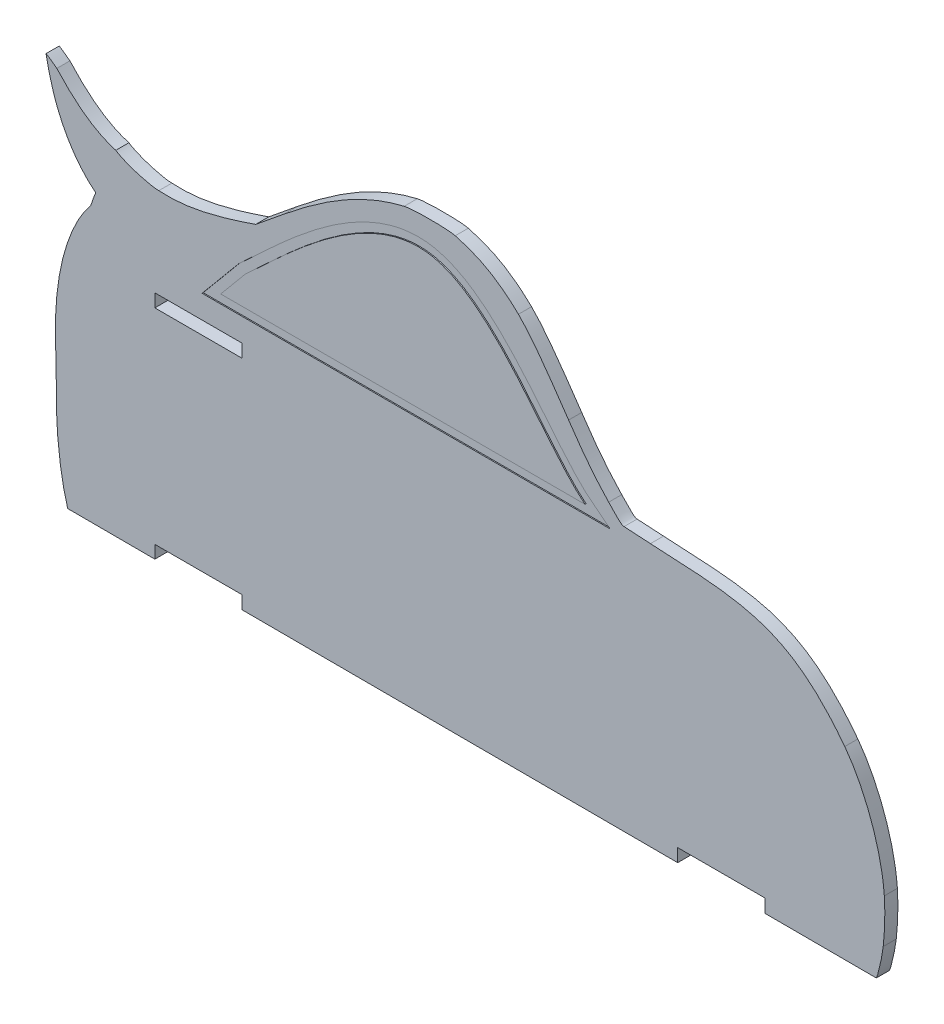
from build123d import *

# Parameters (mm, degrees)
BOSS_EXTRUDE1_DEPTH = 3
SKETCH2_W           = 20
SKETCH2_H           = 3
CUT_EXTRUDE1_DEPTH  = 10
CUT_EXTRUDE2_DEPTH  = 0.25
FILLET1_R           = 490
FILLET3_R           = 20


with BuildPart() as part:
    # Sketch1 → Boss-Extrude1 (new body)
    with BuildSketch(Plane.XY):
        with BuildLine():
            Line((-55.771613477, 211.884964235), (-81.359563224, 211.955586631))
            Line((-81.359563224, 211.955586631), (-81.359563224, 215.010786361))
            Line((-81.359563224, 215.010786361), (-101.359563224, 215.010786361))
            Line((-101.359563224, 215.010786361), (-101.359563224, 212.010786361))
            Line((-101.359563224, 212.010786361), (-201.35903, 212.28678354))
            Line((-201.35903, 212.28678354), (-201.35903, 215.28678354))
            Line((-201.35903, 215.28678354), (-221.35903, 215.28678354))
            Line((-221.35903, 215.28678354), (-221.35903, 212.34198327))
            Line((-221.35903, 212.34198327), (-241.35903, 212.397183))
            add(Edge.make_bspline(
                [(-241.35903, 212.397183), (-243.433200806, 219.233539852), (-244.37501358, 229.532087014), (-243.767840249, 238.737074774)],
                knots=[0, 0, 0, 0, 1, 1, 1, 1], degree=3))
            add(Edge.make_bspline(
                [(-243.767840249, 238.737074774), (-245.3417367, 253.755030644), (-242.442141826, 267.557324246), (-236.098911434, 275.241845869)],
                knots=[0, 0, 0, 0, 1, 1, 1, 1], degree=3))
            add(Edge.make_bspline(
                [(-236.098911434, 275.241845869), (-235.734186419, 276.060814752), (-235.537632123, 276.743555368), (-235.662116873, 276.759057769)],
                knots=[0, 0, 0, 0, 1, 1, 1, 1], degree=3))
            add(Edge.make_bspline(
                [(-235.662116873, 276.759057769), (-235.591127974, 276.862477635), (-235.260826653, 277.597138511), (-234.928115217, 278.391644727)],
                knots=[0, 0, 0, 0, 1, 1, 1, 1], degree=3))
            add(Edge.make_bspline(
                [(-234.928115217, 278.391644727), (-239.348910331, 281.793983673), (-243.122699165, 287.939625439), (-245.028490728, 294.840167335)],
                knots=[0, 0, 0, 0, 1, 1, 1, 1], degree=3))
            add(Edge.make_bspline(
                [(-245.028490728, 294.840167335), (-245.550247129, 296.573870804), (-246.403646496, 300.250938453), (-246.310899804, 300.365745035)],
                knots=[0, 0, 0, 0, 1, 1, 1, 1], degree=3))
            add(Edge.make_bspline(
                [(-246.310899804, 300.365745035), (-246.297955678, 300.428351845), (-245.194510621, 299.656108866), (-243.858829054, 298.649604138)],
                knots=[0, 0, 0, 0, 1, 1, 1, 1], degree=3))
            add(Edge.make_bspline(
                [(-243.858829054, 298.649604138), (-239.139760648, 293.437037617), (-234.88048493, 290.445021181), (-230.313280496, 289.134244505)],
                knots=[0, 0, 0, 0, 1, 1, 1, 1], degree=3))
            add(Edge.make_bspline(
                [(-230.313280496, 289.134244505), (-228.476266882, 287.808285747), (-222.916561014, 286.061770109), (-220.455333428, 286.037508782)],
                knots=[0, 0, 0, 0, 1, 1, 1, 1], degree=3))
            add(Edge.make_bspline(
                [(-220.455333428, 286.037508782), (-214.594566251, 285.692008955), (-208.668289514, 286.869079887), (-198.217921477, 290.454290235)],
                knots=[0, 0, 0, 0, 1, 1, 1, 1], degree=3))
            add(Edge.make_bspline(
                [(-198.217921477, 290.454290235), (-196.173393477, 292.118481235), (-193.224738477, 294.519464235), (-191.665350477, 295.789808235)],
                knots=[0, 0, 0, 0, 1, 1, 1, 1], degree=3))
            add(Edge.make_bspline(
                [(-191.665350477, 295.789808235), (-181.123444477, 304.377742235), (-172.648779477, 309.090312235), (-164.131959477, 311.100493235)],
                knots=[0, 0, 0, 0, 1, 1, 1, 1], degree=3))
            add(Edge.make_bspline(
                [(-164.131959477, 311.100493235), (-162.075544477, 311.585852235), (-154.282194477, 311.583190235), (-152.412943477, 311.096855235)],
                knots=[0, 0, 0, 0, 1, 1, 1, 1], degree=3))
            add(Edge.make_bspline(
                [(-152.412943477, 311.096855235), (-146.791988477, 309.633287235), (-142.504601477, 307.167024235), (-137.901986477, 302.749608235)],
                knots=[0, 0, 0, 0, 1, 1, 1, 1], degree=3))
            add(Edge.make_bspline(
                [(-137.901986477, 302.749608235), (-135.553087477, 300.495235235), (-132.370938477, 296.273870235), (-126.391682477, 287.480322235)],
                knots=[0, 0, 0, 0, 1, 1, 1, 1], degree=3))
            add(Edge.make_bspline(
                [(-126.391682477, 287.480322235), (-122.648888477, 281.975879235), (-120.611935477, 279.375243235), (-117.201573477, 275.747032235)],
                knots=[0, 0, 0, 0, 1, 1, 1, 1], degree=3))
            add(Edge.make_bspline(
                [(-117.201573477, 275.747032235), (-114.779872477, 273.170633235), (-114.274522477, 272.728335235), (-113.673270477, 272.659053235)],
                knots=[0, 0, 0, 0, 1, 1, 1, 1], degree=3))
            add(Edge.make_bspline(
                [(-113.673270477, 272.659053235), (-113.287311477, 272.614543235), (-110.559377477, 272.454465235), (-107.611210477, 272.303276235)],
                knots=[0, 0, 0, 0, 1, 1, 1, 1], degree=3))
            add(Edge.make_bspline(
                [(-107.611210477, 272.303276235), (-86.346815477, 271.212768235), (-75.919051477, 271.227091235), (-63.008175477, 254.273392235)],
                knots=[0, 0, 0, 0, 1, 1, 1, 1], degree=3))
            add(Edge.make_bspline(
                [(-63.008175477, 254.273392235), (-58.796714477, 248.743189235), (-54.645708477, 238.666261235), (-53.930170477, 229.128885235)],
                knots=[0, 0, 0, 0, 1, 1, 1, 1], degree=3))
            add(Edge.make_bspline(
                [(-53.930170477, 229.128885235), (-53.721105477, 226.342367235), (-53.792620477, 222.226585235), (-54.187873477, 218.929577235)],
                knots=[0, 0, 0, 0, 1, 1, 1, 1], degree=3))
            add(Edge.make_bspline(
                [(-54.187873477, 218.929577235), (-54.490646477, 216.403965235), (-55.330161477, 212.748448235), (-55.771613477, 211.884964235)],
                knots=[0, 0, 0, 0, 1, 1, 1, 1], degree=3))
        make_face()
    extrude(amount=BOSS_EXTRUDE1_DEPTH)

    # Sketch2 → Cut-Extrude1 (cut)
    with BuildSketch(Plane.XY.offset(3)):
        with Locations((-211.35903, 263.78678354)):
            Rectangle(SKETCH2_W, SKETCH2_H)
    extrude(amount=-CUT_EXTRUDE1_DEPTH, mode=Mode.SUBTRACT)

    # Sketch3 → Cut-Extrude2 (cut)
    with BuildSketch(Plane.XY.offset(3)):
        with BuildLine():
            Line((-116.868078285, 270.610137644), (-210.515138227, 270.610137644))
            add(Edge.make_bspline(
                [(-210.515138227, 270.610137644), (-207.70545666, 273.981755523), (-204.895775094, 277.353373403), (-202.086093528, 280.724991282)],
                knots=[-0.016370448, -0.016370448, -0.016370448, -0.016370448, 1.487830463, 1.487830463, 1.487830463, 1.487830463], degree=3))
            add(Edge.make_bspline(
                [(-202.086093528, 280.724991282), (-201.766234136, 281.012976719), (-201.144139601, 281.577239578), (-199.786496921, 282.829895906), (-197.964221503, 284.533273518), (-195.576523782, 286.761310892), (-192.162134227, 289.891662395), (-187.50773268, 293.965058043), (-181.45316595, 298.659090822), (-175.059283421, 302.712451052), (-168.430508839, 305.669716279), (-162.772920874, 306.800498019), (-158.227383425, 306.597875257), (-153.773816434, 305.539082012), (-148.617979666, 302.864179961), (-142.948146748, 298.224394235), (-137.704633986, 292.728150104), (-132.840288674, 286.925849289), (-129.093423169, 282.29792081), (-126.29098522, 279.00745692), (-124.295352757, 276.820107186), (-122.733571759, 275.296680217), (-121.780259282, 274.481794778), (-121.354541261, 274.144686547), (-121.032576368, 273.89129731), (-120.174428775, 273.21494435), (-118.753402125, 272.095580379), (-117.497087951, 271.105712044), (-116.868078285, 270.610137644)],
                knots=[-0.00190331, -0.00190331, -0.00190331, -0.00190331, 0.015021831, 0.031946973, 0.065797257, 0.09964754, 0.133497824, 0.201198391, 0.268898959, 0.336599526, 0.404300093, 0.47200066, 0.505850944, 0.539701228, 0.607401795, 0.675102362, 0.742802929, 0.810503496, 0.878204064, 0.912054347, 0.945904631, 0.979754915, 0.996680056, 1.000911342, 1.005142627, 1.013605198, 1.047455482, 1.081305765, 1.081305765, 1.081305765, 1.081305765], degree=3))
        make_face()
        with BuildLine():
            Line((-122.638306737, 272.610137644), (-206.245055001, 272.610137644))
            Line((-206.245055001, 272.610137644), (-200.641385547, 279.33454099))
            add(Edge.make_bspline(
                [(-200.641385547, 279.33454099), (-191.110400539, 287.915764347), (-155.998393866, 325.235868613), (-131.724200162, 279.768590736), (-122.638306737, 272.610137644)],
                knots=[0, 0, 0, 0, 0.511040789, 1, 1, 1, 1], degree=3))
        make_face(mode=Mode.SUBTRACT)
    extrude(amount=-CUT_EXTRUDE2_DEPTH, mode=Mode.SUBTRACT)

    # Fillet1
    fillet1_edges = [part.edges().sort_by_distance(p)[0] for p in [
        (-243.767840249, 238.737074774, 1.5),
    ]]
    fillet(fillet1_edges, radius=FILLET1_R)

    # Fillet3
    fillet3_edges = [part.edges().sort_by_distance(p)[0] for p in [
        (-235.662116873, 276.759057769, 1.5),
    ]]
    fillet(fillet3_edges, radius=FILLET3_R)


solid = part.part
